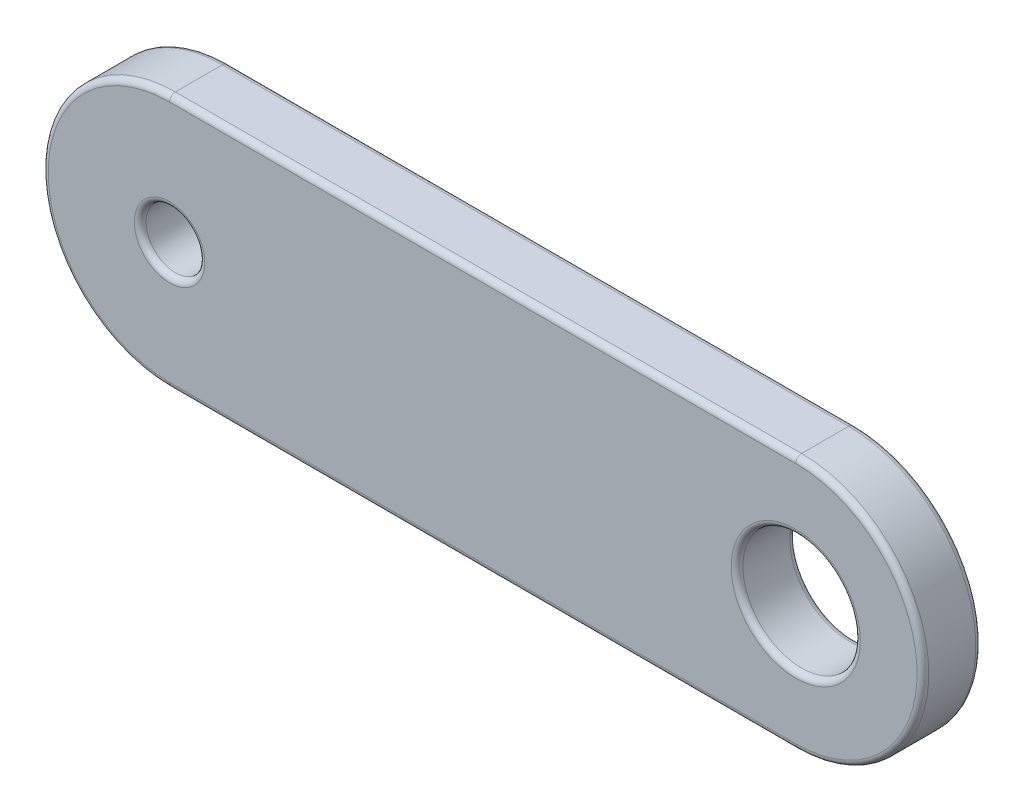
from build123d import *

# Parameters (mm, degrees)
SKETCH1_R           = 0.75
SKETCH1_R_2         = 1.5
BOSS_EXTRUDE1_DEPTH = 0.75
FILLET1_R           = 0.15


with BuildPart() as part:
    # Sketch1 → Boss-Extrude1 (new, symmetric)
    with BuildSketch(Plane.XY):
        with BuildLine():
            Line((-8, 3.25), (8, 3.25))
            ThreePointArc((8, 3.25), (11.25, 0), (8, -3.25))
            Line((8, -3.25), (-8, -3.25))
            ThreePointArc((-8, -3.25), (-11.25, 0), (-8, 3.25))
        make_face()
        with Locations((-8, 0)):
            Circle(SKETCH1_R, mode=Mode.SUBTRACT)
        with Locations((8, 0)):
            Circle(SKETCH1_R_2, mode=Mode.SUBTRACT)
    extrude(amount=BOSS_EXTRUDE1_DEPTH, both=True)

    # Fillet1
    fillet1_edges = [part.edges().sort_by_distance(p)[0] for p in [
        (-8.75, 0, -0.75),
        (-8.75, 0, 0.75),
        (11.25, 0, 0.75),
        (6.5, 0, -0.75),
        (6.5, 0, 0.75),
        (0, 3.25, 0.75),
        (-11.25, 0, 0.75),
        (0, 3.25, -0.75),
        (11.25, 0, -0.75),
        (0, -3.25, -0.75),
        (-11.25, 0, -0.75),
        (0, -3.25, 0.75),
    ]]
    fillet(fillet1_edges, radius=FILLET1_R)


solid = part.part
